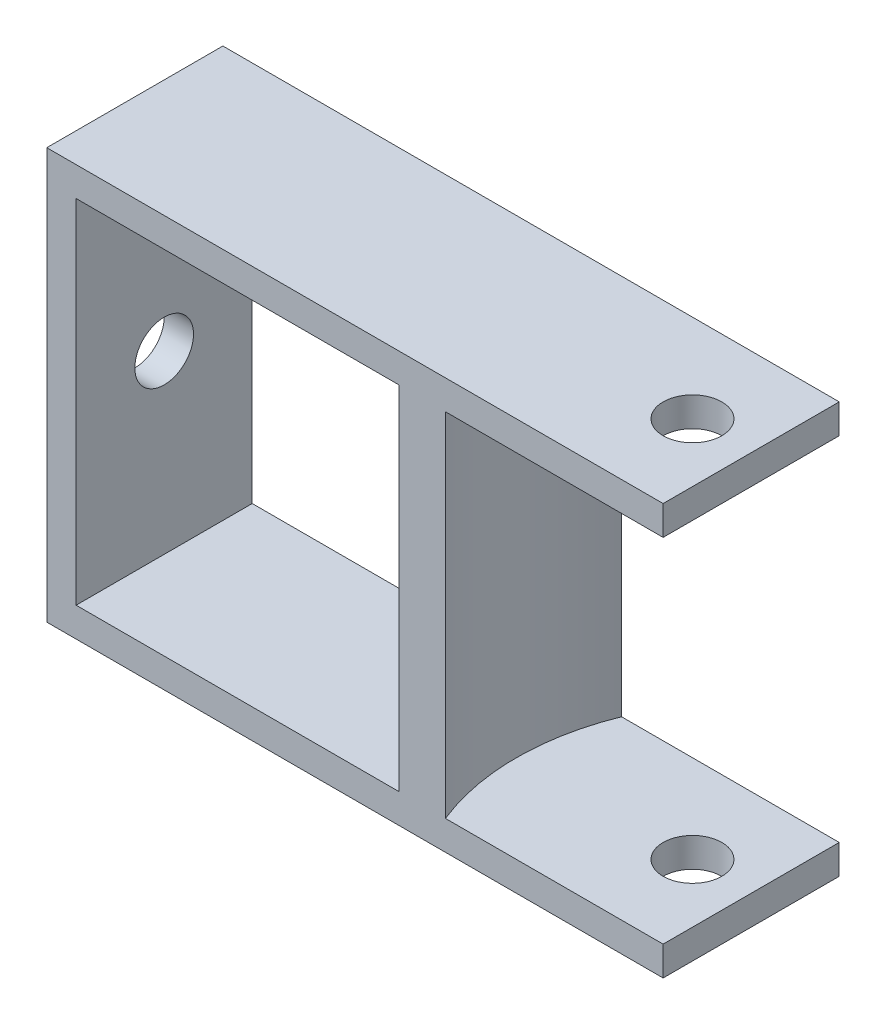
from build123d import *

# Parameters (mm, degrees)
CROQUIS1_W                 = 105
CROQUIS1_H                 = 30
CROQUIS1_R                 = 5
SALIENTE_EXTRUIR1_DEPTH    = 70
CORTAR_EXTRUIR1_DEPTH      = 30
CORTAR_EXTRUIR1_DEPTH_BACK = 30
CROQUIS2_R                 = 40
CROQUIS3_R                 = 5
CORTAR_EXTRUIR2_DEPTH      = 30
CROQUIS4_W                 = 55
CROQUIS4_H                 = 60
CORTAR_EXTRUIR3_DEPTH      = 30


with BuildPart() as part:
    # Croquis1 → Saliente-Extruir1 (new body)
    with BuildSketch(Plane(origin=(0, 0, 0), x_dir=(1, 0, 0), z_dir=(0, 1, 0))):
        with Locations((14.264686972, 6.108870968)):
            Rectangle(CROQUIS1_W, CROQUIS1_H)
        with Locations(Location((56.764686972, 6.108870968, 0), (0, 0, 270))):
            Circle(CROQUIS1_R, mode=Mode.SUBTRACT)
    extrude(amount=SALIENTE_EXTRUIR1_DEPTH)

    # Croquis2 → Cortar-Extruir1 (cut, two sides: drawn at the far end of the back side and taken through both)
    with BuildSketch(Plane(origin=(0, 35, 0), x_dir=(-1, 0, 0), z_dir=(0, -1, 0)).offset(-CORTAR_EXTRUIR1_DEPTH_BACK)):
        with Locations((-66.764686972, 6.108870968)):
            Circle(CROQUIS2_R)
    extrude(amount=CORTAR_EXTRUIR1_DEPTH + CORTAR_EXTRUIR1_DEPTH_BACK, mode=Mode.SUBTRACT)

    # Croquis3 → Cortar-Extruir2 (cut)
    with BuildSketch(Plane.ZY.offset(38.235313028)):
        with Locations((-6.108870968, 35)):
            Circle(CROQUIS3_R)
    extrude(amount=-CORTAR_EXTRUIR2_DEPTH, mode=Mode.SUBTRACT)

    # Croquis4 → Cortar-Extruir3 (cut)
    with BuildSketch(Plane.XY.offset(8.891129032)):
        with Locations((-5.735313028, 35)):
            Rectangle(CROQUIS4_W, CROQUIS4_H)
    extrude(amount=-CORTAR_EXTRUIR3_DEPTH, mode=Mode.SUBTRACT)


solid = part.part
